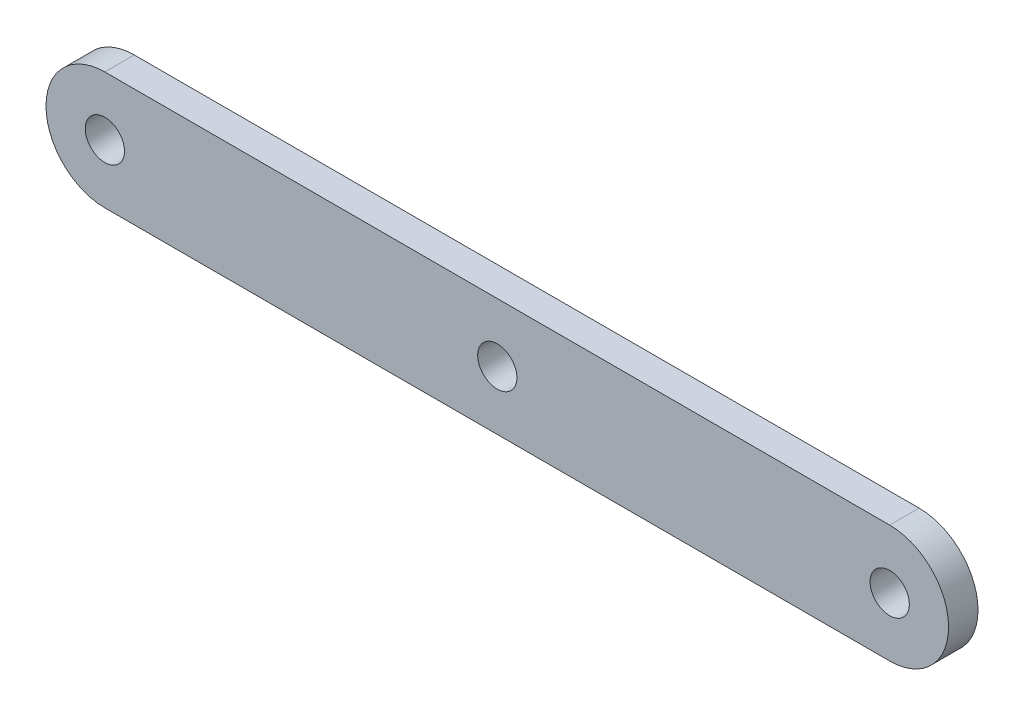
from build123d import *

# Parameters (mm, degrees)
SKETCH1_R           = 2
BOSS_EXTRUDE3_DEPTH = 3


with BuildPart() as part:
    # Sketch1 → Boss-Extrude3 (new body)
    with BuildSketch(Plane.XY):
        with BuildLine():
            Line((-35.312724167, 6), (44.687275833, 6))
            ThreePointArc((44.687275833, 6), (50.687275833, 0), (44.687275833, -6))
            Line((44.687275833, -6), (-35.312724167, -6))
            ThreePointArc((-35.312724167, -6), (-41.312724167, 0), (-35.312724167, 6))
        make_face()
        with Locations((-35.312724167, 0)):
            Circle(SKETCH1_R, mode=Mode.SUBTRACT)
        with Locations((44.687275833, 0)):
            Circle(SKETCH1_R, mode=Mode.SUBTRACT)
        with Locations((4.687275833, 0)):
            Circle(SKETCH1_R, mode=Mode.SUBTRACT)
    extrude(amount=BOSS_EXTRUDE3_DEPTH)


solid = part.part
